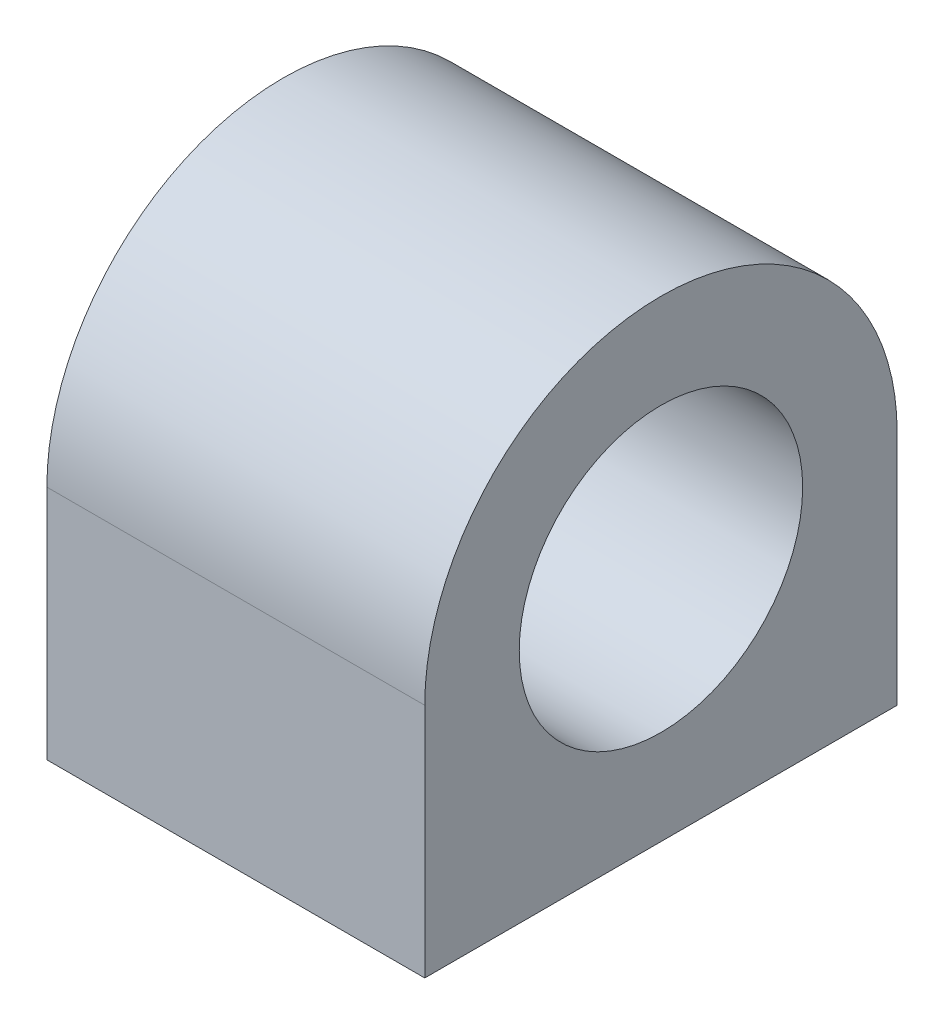
from build123d import *

# Parameters (mm, degrees)
ESQUISSE3_R             = 12.5
ESQUISSE3_W             = 25
ESQUISSE3_H             = 12.5
BOSS_EXTRU_2_DEPTH      = 20
ESQUISSE4_R             = 7.5
ENL_V_MAT_EXTRU_1_DEPTH = 41.620192023
TROU_TARAUD_M51_D       = 4.2
TROU_TARAUD_M51_DEPTH   = 5
TROU_TARAUD_M51_TIP     = 1.2618073


with BuildPart() as part:
    # Esquisse3 → Boss.-Extru.2 (new body)
    with BuildSketch(Plane(origin=(0, 0, 0), x_dir=(0, 0, -1), z_dir=(1, 0, 0))):
        with Locations((12.5, 12.5)):
            Circle(ESQUISSE3_R)
        with Locations((12.5, 6.25)):
            Rectangle(ESQUISSE3_W, ESQUISSE3_H)
    extrude(amount=BOSS_EXTRU_2_DEPTH)

    # Esquisse4 → Enlèv. mat.-Extru.1 (cut, through all)
    with BuildSketch(Plane.ZY):
        with Locations((-12.5, 12.5)):
            Circle(ESQUISSE4_R)
    extrude(amount=-ENL_V_MAT_EXTRU_1_DEPTH, mode=Mode.SUBTRACT)

    # Trou taraudé M51
    with Locations(Plane(origin=(10, 0, -5), x_dir=(0, 0, -1), z_dir=(0, -1, 0))):
        with Locations((0, 0), (15, 0)):
            Hole(TROU_TARAUD_M51_D / 2, depth=TROU_TARAUD_M51_DEPTH)
            with Locations((0, 0, -(TROU_TARAUD_M51_DEPTH + TROU_TARAUD_M51_TIP / 2))):  # 118° drill point
                Cone(0, TROU_TARAUD_M51_D / 2, TROU_TARAUD_M51_TIP, mode=Mode.SUBTRACT)


solid = part.part
